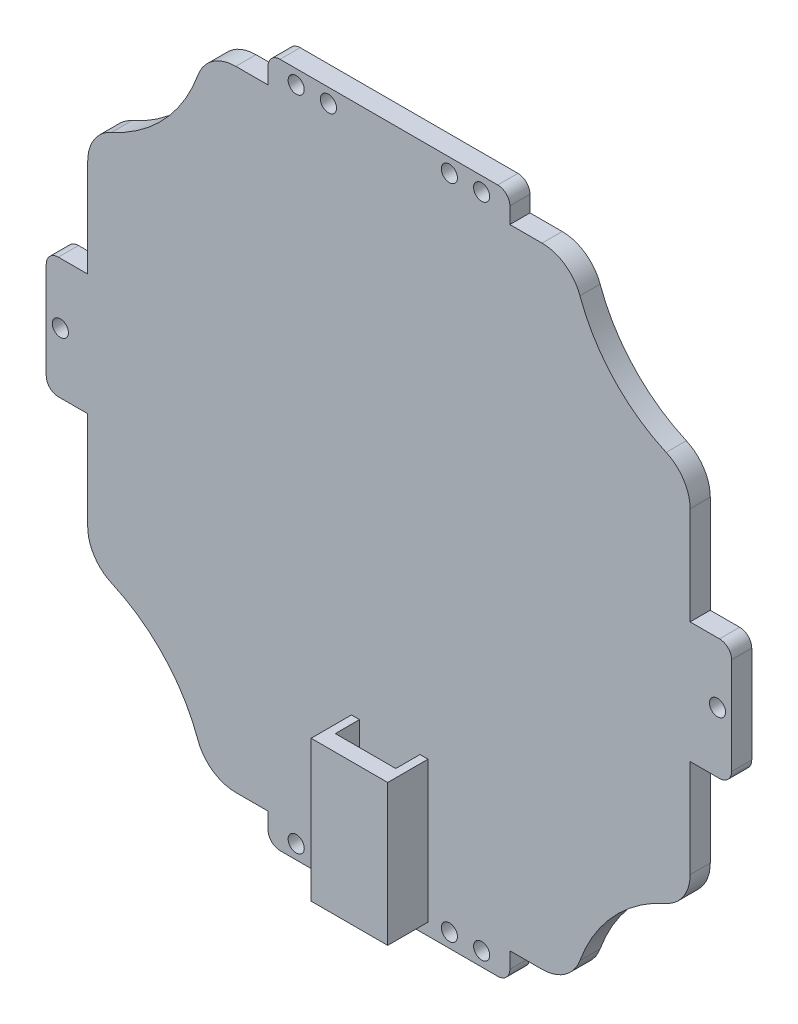
from build123d import *

# Parameters (mm, degrees)
BOSS_EXTRUDE1_DEPTH = 5
SKETCH2_R           = 2
CUT_EXTRUDE1_DEPTH  = 5
CUT_EXTRUDE2_DEPTH  = 3
SKETCH4_W           = 19
SKETCH4_H           = 35
BOSS_EXTRUDE2_DEPTH = 10
SKETCH6_W           = 15
SKETCH6_H           = 8
CUT_EXTRUDE4_DEPTH  = 33
SKETCH7_W           = 15
SKETCH7_H           = 6
CUT_EXTRUDE5_DEPTH  = 2


with BuildPart() as part:
    # Sketch1 → Boss-Extrude1 (new body)
    with BuildSketch(Plane.XY):
        with BuildLine():
            Line((82, 15), (74.70882917, 15))
            Line((74.70882917, 15), (74.70882917, 39.302424721))
            ThreePointArc((74.70882917, 39.302424721), (73.092812163, 44.753005348), (68.767063336, 48.441939777))
            ThreePointArc((68.767063336, 48.441939777), (55.730177295, 57.736884279), (47.382982574, 71.4))
            ThreePointArc((47.382982574, 71.4), (43.723290865, 76.185352772), (37.978728218, 78))
            Line((37.978728218, 78), (30, 78))
            Line((30, 78), (30, 82))
            ThreePointArc((30, 82), (29.121320344, 84.121320344), (27, 85))
            Line((27, 85), (-27, 85))
            ThreePointArc((-27, 85), (-29.121320344, 84.121320344), (-30, 82))
            Line((-30, 82), (-30, 78))
            Line((-30, 78), (-37.978728218, 78))
            ThreePointArc((-37.978728218, 78), (-43.723290865, 76.185352772), (-47.382982574, 71.4))
            ThreePointArc((-47.382982574, 71.4), (-55.730177295, 57.736884279), (-68.767063336, 48.441939777))
            ThreePointArc((-68.767063336, 48.441939777), (-73.092812163, 44.753005348), (-74.70882917, 39.302424721))
            Line((-74.70882917, 39.302424721), (-74.70882917, 15))
            Line((-74.70882917, 15), (-82, 15))
            ThreePointArc((-82, 15), (-84.121320344, 14.121320344), (-85, 12))
            Line((-85, 12), (-85, -12))
            ThreePointArc((-85, -12), (-84.121320344, -14.121320344), (-82, -15))
            Line((-82, -15), (-74.70882917, -15))
            Line((-74.70882917, -15), (-74.70882917, -39.302424721))
            ThreePointArc((-74.70882917, -39.302424721), (-73.092812163, -44.753005348), (-68.767063336, -48.441939777))
            ThreePointArc((-68.767063336, -48.441939777), (-55.730177295, -57.736884279), (-47.382982574, -71.4))
            ThreePointArc((-47.382982574, -71.4), (-43.723290865, -76.185352772), (-37.978728218, -78))
            Line((-37.978728218, -78), (-30, -78))
            Line((-30, -78), (-30, -82))
            ThreePointArc((-30, -82), (-29.121320344, -84.121320344), (-27, -85))
            Line((-27, -85), (27, -85))
            ThreePointArc((27, -85), (29.121320344, -84.121320344), (30, -82))
            Line((30, -82), (30, -78))
            Line((30, -78), (37.978728218, -78))
            ThreePointArc((37.978728218, -78), (43.723290865, -76.185352772), (47.382982574, -71.4))
            ThreePointArc((47.382982574, -71.4), (55.730177295, -57.736884279), (68.767063336, -48.441939777))
            ThreePointArc((68.767063336, -48.441939777), (73.092812163, -44.753005348), (74.70882917, -39.302424721))
            Line((74.70882917, -39.302424721), (74.70882917, -15))
            Line((74.70882917, -15), (82, -15))
            ThreePointArc((82, -15), (84.121320344, -14.121320344), (85, -12))
            Line((85, -12), (85, 12))
            ThreePointArc((85, 12), (84.121320344, 14.121320344), (82, 15))
        make_face()
    extrude(amount=BOSS_EXTRUDE1_DEPTH)

    # Sketch2 → Cut-Extrude1 (cut)
    with BuildSketch(Plane(origin=(0, 0, 0), x_dir=(-1, 0, 0), z_dir=(0, 0, -1))):
        with Locations((81.5, 0)):
            Circle(SKETCH2_R)
        with Locations(Location((-81.5, 0, 0), (0, 0, 180))):
            Circle(SKETCH2_R)
        with Locations((-23, 81.5)):
            Circle(SKETCH2_R)
        with Locations((15, 81.5)):
            Circle(SKETCH2_R)
        with Locations((23, 81.5)):
            Circle(SKETCH2_R)
        with Locations((-15, 81.5)):
            Circle(SKETCH2_R)
        with Locations(Location((-23, -81.5, 0), (0, 0, 180))):
            Circle(SKETCH2_R)
        with Locations(Location((-15, -81.5, 0), (0, 0, 180))):
            Circle(SKETCH2_R)
        with Locations(Location((15, -81.5, 0), (0, 0, 180))):
            Circle(SKETCH2_R)
        with Locations(Location((23, -81.5, 0), (0, 0, 180))):
            Circle(SKETCH2_R)
    extrude(amount=-CUT_EXTRUDE1_DEPTH, mode=Mode.SUBTRACT)

    # Sketch3 → Cut-Extrude2 (cut)
    with BuildSketch(Plane(origin=(0, 0, 0), x_dir=(-1, 0, 0), z_dir=(0, 0, -1))):
        Polygon((-30, -70), (-45, -44.019237886), (45, -44.019237886), (30, -70), align=None)
        Polygon((65, 45), (-65, 45), (-45, 10.358983849), (45, 10.358983849), align=None)
    extrude(amount=-CUT_EXTRUDE2_DEPTH, mode=Mode.SUBTRACT)

    # Sketch4 → Boss-Extrude2 (add)
    with BuildSketch(Plane.XY.offset(5)):
        with Locations((0.2, -64.5)):
            Rectangle(SKETCH4_W, SKETCH4_H)
    extrude(amount=BOSS_EXTRUDE2_DEPTH)

    # Sketch6 → Cut-Extrude4 (cut)
    with BuildSketch(Plane.XZ.offset(82)):
        with Locations((0.2, 9)):
            Rectangle(SKETCH6_W, SKETCH6_H)
    extrude(amount=-CUT_EXTRUDE4_DEPTH, mode=Mode.SUBTRACT)

    # Sketch7 → Cut-Extrude5 (cut)
    with BuildSketch(Plane(origin=(0, -47, 0), x_dir=(1, 0, 0), z_dir=(0, 1, 0))):
        with Locations((0.2, -8)):
            Rectangle(SKETCH7_W, SKETCH7_H)
    extrude(amount=-CUT_EXTRUDE5_DEPTH, mode=Mode.SUBTRACT)


solid = part.part
